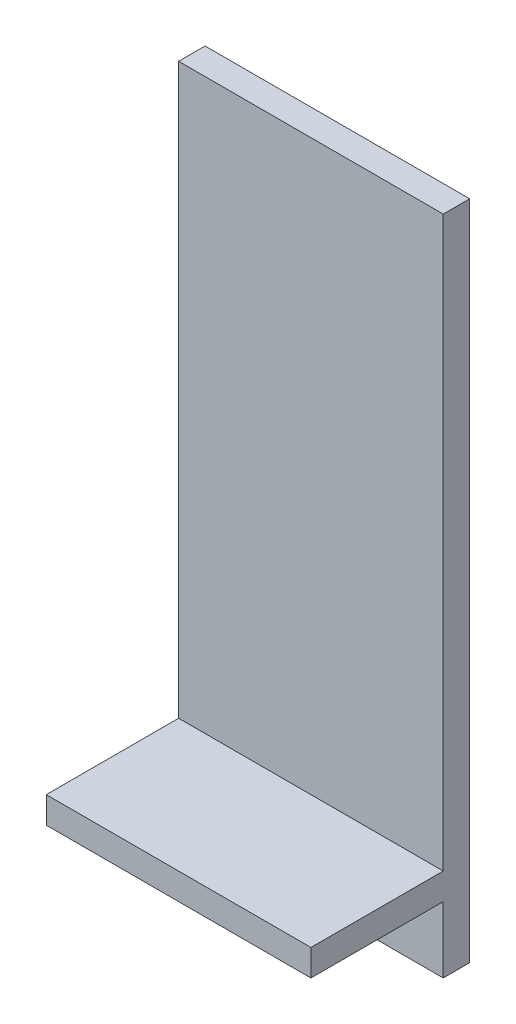
from build123d import *

# Parameters (mm, degrees)
CROQUIS1_W              = 20
CROQUIS1_H              = 2
SALIENTE_EXTRUIR1_DEPTH = 50
CROQUIS2_W              = 4
CROQUIS2_H              = 5
SALIENTE_EXTRUIR2_DEPTH = 4
SALIENTE_EXTRUIR3_DEPTH = 10


with BuildPart() as part:
    # Croquis1 → Saliente-Extruir1 (new body)
    with BuildSketch(Plane(origin=(0, 0, 0), x_dir=(1, 0, 0), z_dir=(0, 1, 0))):
        with Locations((10, 1)):
            Rectangle(CROQUIS1_W, CROQUIS1_H)
    extrude(amount=SALIENTE_EXTRUIR1_DEPTH)

    # Croquis2 → Saliente-Extruir2 (add)
    with BuildSketch(Plane.XY):
        with Locations((10, 2.5)):
            Rectangle(CROQUIS2_W, CROQUIS2_H)
    extrude(amount=SALIENTE_EXTRUIR2_DEPTH)

    # Croquis3 → Saliente-Extruir3 (add)
    with BuildSketch(Plane.XY):
        Polygon((12, 5), (20, 5), (20, 7), (0, 7), (0, 5), align=None)
    extrude(amount=SALIENTE_EXTRUIR3_DEPTH)


solid = part.part
